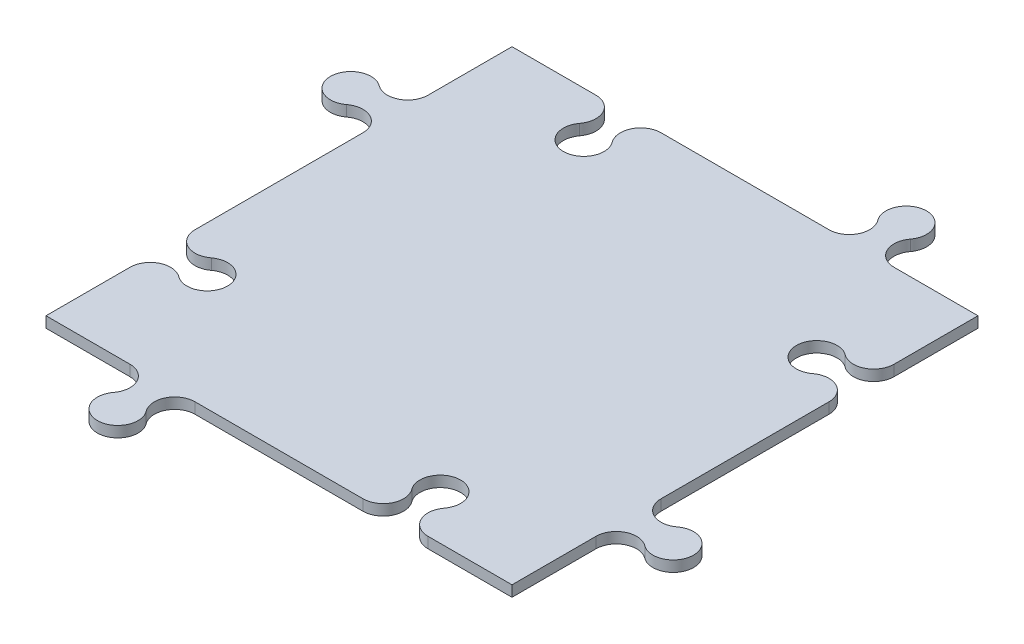
from build123d import *

# Parameters (mm, degrees)
SKETCH1_W           = 136.4
SKETCH1_H           = 136.4
BOSS_EXTRUDE1_DEPTH = 3.175
BOSS_EXTRUDE2_DEPTH = 3.175
CUT_EXTRUDE2_DEPTH  = 111.78755853
CIRPATTERN1_COUNT   = 4


with BuildPart() as part:
    # Sketch1 → Boss-Extrude1 (new body)
    with BuildSketch(Plane(origin=(0, 0, 0), x_dir=(1, 0, 0), z_dir=(0, 1, 0))):
        Rectangle(SKETCH1_W, SKETCH1_H)
    extrude(amount=BOSS_EXTRUDE1_DEPTH)

    # Sketch2 → Boss-Extrude2 (add)
    with BuildSketch(Plane(origin=(0, 0, 0), x_dir=(1, 0, 0), z_dir=(0, 1, 0))):
        with BuildLine():
            Line((-68.2, 43.625), (-68.2, 24.575))
            ThreePointArc((-68.2, 24.575), (-71.490806564, 29.899636871), (-77.725, 29.3375))
            ThreePointArc((-77.725, 29.3375), (-83.959193436, 28.775363129), (-87.25, 34.1))
            ThreePointArc((-87.25, 34.1), (-83.959193436, 39.424636871), (-77.725, 38.8625))
            ThreePointArc((-77.725, 38.8625), (-71.490806564, 38.300363129), (-68.2, 43.625))
        make_face()
    boss_extrude2 = extrude(amount=BOSS_EXTRUDE2_DEPTH)

    # Sketch2<3> → Cut-Extrude2 (cut, through all)
    with BuildSketch(Plane(origin=(0, 0, 0), x_dir=(1, 0, 0), z_dir=(0, 1, 0))):
        with BuildLine():
            Line((-68.2, -43.625), (-68.2, -24.575))
            ThreePointArc((-68.2, -24.575), (-64.909193436, -29.899636871), (-58.675, -29.3375))
            ThreePointArc((-58.675, -29.3375), (-52.440806564, -28.775363129), (-49.15, -34.1))
            ThreePointArc((-49.15, -34.1), (-52.440806564, -39.424636871), (-58.675, -38.8625))
            ThreePointArc((-58.675, -38.8625), (-64.909193436, -38.300363129), (-68.2, -43.625))
        make_face()
    cut_extrude2 = extrude(amount=CUT_EXTRUDE2_DEPTH, mode=Mode.SUBTRACT)

    # CirPattern1: Boss-Extrude2, Cut-Extrude2 ×4 about axis
    cirpattern1_axis = Axis((0, 0, 0), (0, 1, 0))
    add([boss_extrude2.rotate(cirpattern1_axis, i * 360 / CIRPATTERN1_COUNT) for i in range(1, CIRPATTERN1_COUNT)])
    add([cut_extrude2.rotate(cirpattern1_axis, i * 360 / CIRPATTERN1_COUNT) for i in range(1, CIRPATTERN1_COUNT)], mode=Mode.SUBTRACT)


solid = part.part
